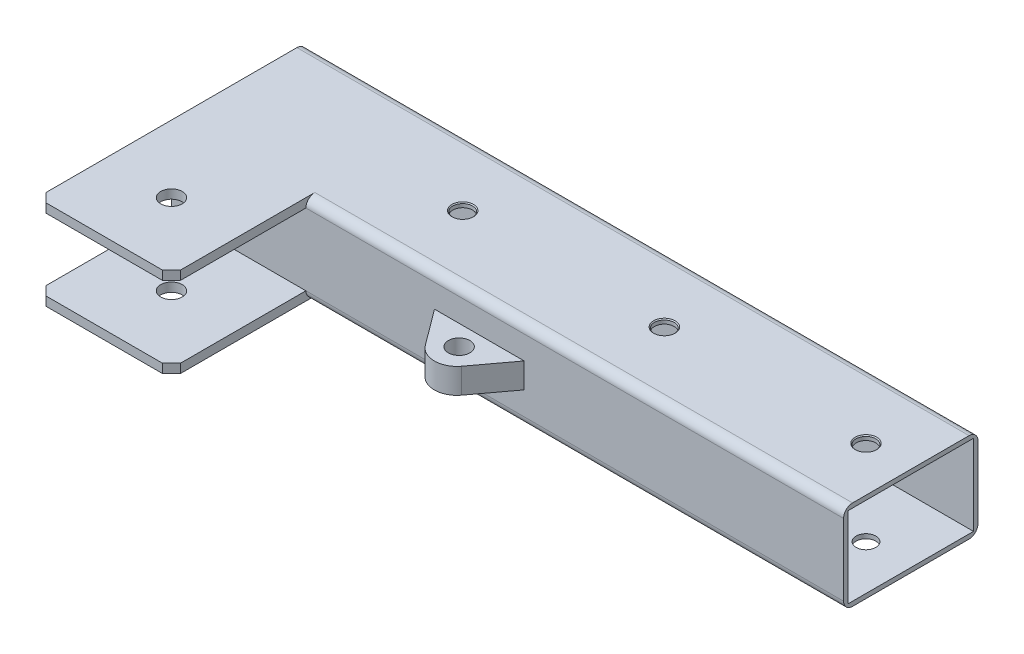
from build123d import *

# Parameters (mm, degrees)
SKETCH1_R                        = 12
BOSS_EXTRUDE1_DEPTH              = 100
SKETCH2_W                        = 140
SKETCH2_H                        = 90
CUT_EXTRUDE1_DEPTH               = 790.382670192
CUT_EXTRUDE2_START               = 225
SKETCH3_W                        = 47.5
SKETCH3_H                        = 80
SKETCH3_W_2                      = 102.5
SKETCH3_W_3                      = 150
CUT_EXTRUDE2_DEPTH               = 150
FILLET2_R                        = 10
FILLET4_R                        = 10
CHAMFER1_SIZE                    = 10
M24X2_0_TAPPED_HOLE1_D           = 22
M24X2_0_TAPPED_HOLE1_CSINK_D     = 24.05
M24X2_0_TAPPED_HOLE1_CSINK_ANGLE = 90
BOSS_EXTRUDE3_START              = -36
SKETCH7_R                        = 12
BOSS_EXTRUDE3_DEPTH              = 28


with BuildPart() as part:
    # Sketch1 → Boss-Extrude1 (new body)
    with BuildSketch(Plane(origin=(0, 0, 0), x_dir=(1, 0, 0), z_dir=(0, 1, 0))):
        Polygon((-375, 75), (375, 75), (375, -75), (-225, -75), (-225, -225), (-375, -225), (-375, -75), align=None)
        with Locations(Location((-300, -150, 0), (0, 0, 270))):
            Circle(SKETCH1_R, mode=Mode.SUBTRACT)
    extrude(amount=BOSS_EXTRUDE1_DEPTH)

    # Sketch2 → Cut-Extrude1 (cut, through all)
    with BuildSketch(Plane(origin=(375, 0, 0), x_dir=(0, 0, -1), z_dir=(1, 0, 0))):
        with Locations((0, 50)):
            Rectangle(SKETCH2_W, SKETCH2_H)
    extrude(amount=-CUT_EXTRUDE1_DEPTH, mode=Mode.SUBTRACT)

    # Sketch3 → Cut-Extrude2 (cut)
    with BuildSketch(Plane.ZY.offset(CUT_EXTRUDE2_START)):
        with Locations((351.25, 50)):
            Rectangle(SKETCH3_W, SKETCH3_H)
        with Locations((276.25, 50)):
            Rectangle(SKETCH3_W_2, SKETCH3_H)
        with Locations((150, 50)):
            Rectangle(SKETCH3_W_3, SKETCH3_H)
    extrude(amount=CUT_EXTRUDE2_DEPTH, mode=Mode.SUBTRACT)

    # Fillet2
    fillet2_edges = [part.edges().sort_by_distance(p)[0] for p in [
        (0, 100, -75),
        (0, 0, -75),
    ]]
    fillet(fillet2_edges, radius=FILLET2_R)

    # Fillet4
    fillet4_edges = [part.edges().sort_by_distance(p)[0] for p in [
        (75, 100, 75),
        (75, 0, 75),
    ]]
    fillet(fillet4_edges, radius=FILLET4_R)

    # Chamfer1
    chamfer1_edges = [part.edges().sort_by_distance(p)[0] for p in [
        (-225, 95, 225),
        (-375, 95, 225),
        (-225, 5, 225),
        (-375, 5, 225),
    ]]
    chamfer(chamfer1_edges, length=CHAMFER1_SIZE)

    # M24x2.0 Tapped Hole1 (through all)
    with Locations(Plane(origin=(0, 100, 0), x_dir=(1, 0, 0), z_dir=(0, 1, 0))):
        with Locations((100, 0), (325, 0), (-125, 0)):
            CounterSinkHole(M24X2_0_TAPPED_HOLE1_D / 2, M24X2_0_TAPPED_HOLE1_CSINK_D / 2, counter_sink_angle=M24X2_0_TAPPED_HOLE1_CSINK_ANGLE)

    # Sketch7 → Boss-Extrude3 (add)
    with BuildSketch(Plane(origin=(0, 100, 0), x_dir=(1, 0, 0), z_dir=(0, 1, 0)).offset(BOSS_EXTRUDE3_START)):
        with BuildLine():
            Line((-81.456914067, -75), (-51.717949801, -115))
            ThreePointArc((-51.717949801, -115), (-31.456914067, -125.183627997), (-11.195878332, -115))
            Line((-11.195878332, -115), (18.543085933, -75))
            Line((18.543085933, -75), (-81.456914067, -75))
        make_face()
        with Locations(Location((-31.456914067, -97.533391436, 0), (0, 0, 270))):
            Circle(SKETCH7_R, mode=Mode.SUBTRACT)
    extrude(amount=-BOSS_EXTRUDE3_DEPTH)


solid = part.part
